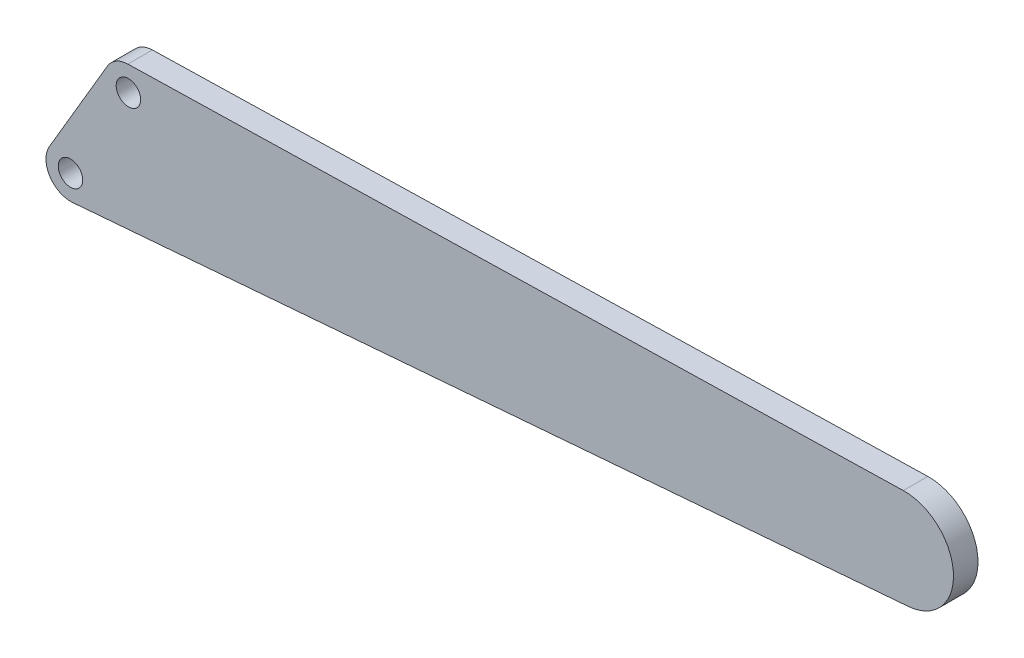
from build123d import *

# Parameters (mm, degrees)
SKETCH3_R           = 1.5
BOSS_EXTRUDE1_DEPTH = 3


with BuildPart() as part:
    # Sketch3 → Boss-Extrude1 (new body)
    with BuildSketch(Plane.XY):
        with BuildLine():
            Line((-9.681295011, -10.548579379), (-2.586204824, 1.520376469))
            ThreePointArc((-2.586204824, 1.520376469), (-1.520557397, 2.586098452), (-0.071160516, 2.999155911))
            Line((-0.071160516, 2.999155911), (94.857678968, 5.25151804))
            ThreePointArc((94.857678968, 5.25151804), (100.991739474, -0.432058845), (95.486888577, -6.727006113))
            Line((95.486888577, -6.727006113), (-6.851645898, -15.059062012))
            ThreePointArc((-6.851645898, -15.059062012), (-9.636397947, -13.663244049), (-9.681295011, -10.548579379))
        make_face()
        with Locations((-7.095090187, -12.068955847)):
            Circle(SKETCH3_R, mode=Mode.SUBTRACT)
        Circle(SKETCH3_R, mode=Mode.SUBTRACT)
    extrude(amount=BOSS_EXTRUDE1_DEPTH)


solid = part.part
